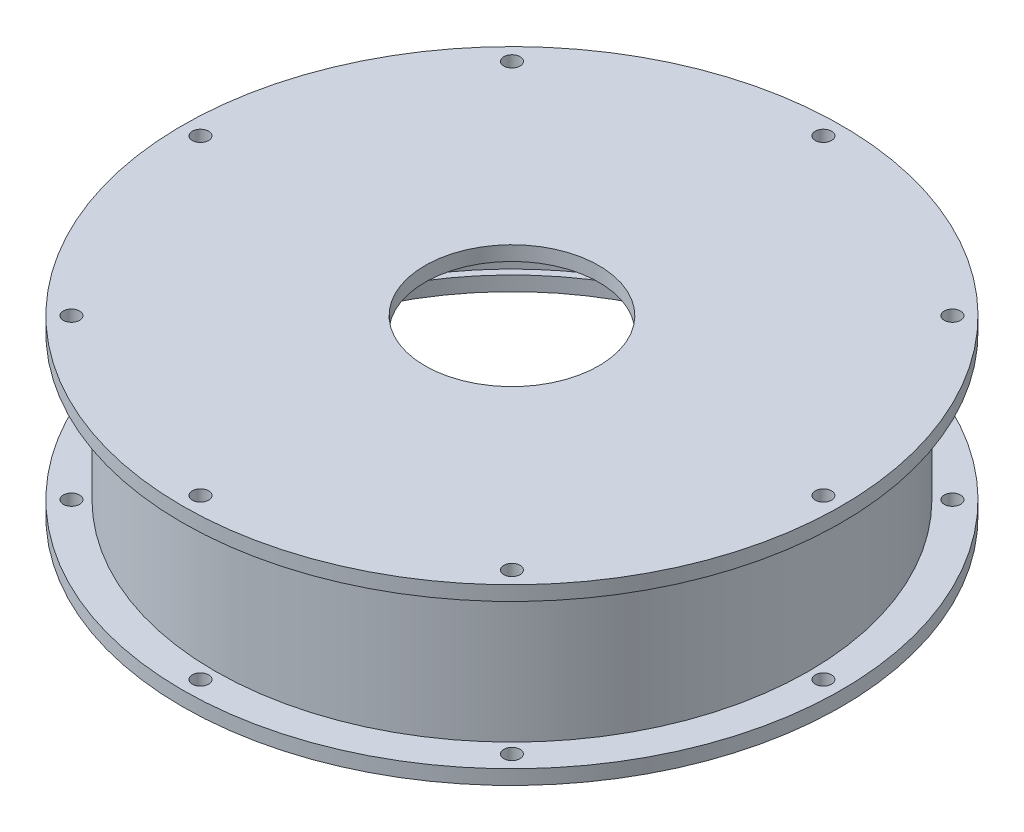
from build123d import *

# Parameters (mm, degrees)
SKETCH1_R               = 144.4625
BOSS_EXTRUDE1_DEPTH     = 6.35
F_1_4_CLEARANCE_HOLE1_D = 7.14248
SKETCH4_R               = 130.175
SKETCH4_R_2             = 123.825
BOSS_EXTRUDE2_DEPTH     = 63.5
SKETCH7_R               = 120.65
CUT_EXTRUDE1_DEPTH      = 69.85
CUT_EXTRUDE2_REACH      = 220.049
SKETCH8_R               = 38.1


with BuildPart() as part:
    # Sketch1 → Boss-Extrude1 (new body)
    with BuildSketch(Plane(origin=(0, 0, 0), x_dir=(1, 0, 0), z_dir=(0, 1, 0))):
        with Locations(Location((0, 0, 0), (0, 0, 270))):
            Circle(SKETCH1_R)
    boss_extrude1 = extrude(amount=BOSS_EXTRUDE1_DEPTH)

    # 1/4 Clearance Hole1 (through all)
    with Locations(Plane(origin=(0, 6.35, 0), x_dir=(1, 0, 0), z_dir=(0, 1, 0))):
        with Locations((-96.537753301, 96.537753301), (0, 136.525), (96.537753301, 96.537753301), (136.525, 0), (96.537753301, -96.537753301), (0, -136.525), (-96.537753301, -96.537753301), (-136.525, 0)):
            f_1_4_clearance_hole1 = Hole(F_1_4_CLEARANCE_HOLE1_D / 2)

    # Sketch4 → Boss-Extrude2 (add)
    with BuildSketch(Plane(origin=(0, 6.35, 0), x_dir=(1, 0, 0), z_dir=(0, 1, 0))):
        with Locations(Location((0, 0, 0), (0, 0, 270))):
            Circle(SKETCH4_R)
        with Locations(Location((0, 0, 0), (0, 0, 270))):
            Circle(SKETCH4_R_2, mode=Mode.SUBTRACT)
    extrude(amount=BOSS_EXTRUDE2_DEPTH)

    # Mirror2: Boss-Extrude1 across plane
    add(boss_extrude1.mirror(Plane.ZX.offset(38.1)))

    # Mirror3: 1/4 Clearance Hole1 across plane
    add(f_1_4_clearance_hole1.mirror(Plane.ZX.offset(38.1)), mode=Mode.SUBTRACT)

    # Sketch7 → Cut-Extrude1 (cut)
    with BuildSketch(Plane.XZ):
        with Locations(Location((0, 0, 0), (0, 0, 270))):
            Circle(SKETCH7_R)
    extrude(amount=-CUT_EXTRUDE1_DEPTH, mode=Mode.SUBTRACT)

    # Sketch8 → Cut-Extrude2 (cut, up to next)
    with BuildSketch(Plane(origin=(0, 76.2, 0), x_dir=(1, 0, 0), z_dir=(0, 1, 0)), mode=Mode.PRIVATE) as cut_extrude2_sk1:
        with Locations(Location((0, 0, 0), (0, 0, 270))):
            Circle(SKETCH8_R)
    cut_extrude2_tool1 = extrude(cut_extrude2_sk1.sketch, amount=-CUT_EXTRUDE2_REACH, mode=Mode.PRIVATE) & part.part
    add(cut_extrude2_tool1.solids().sort_by_distance((0, 76.2, 0))[0], mode=Mode.SUBTRACT)


solid = part.part
